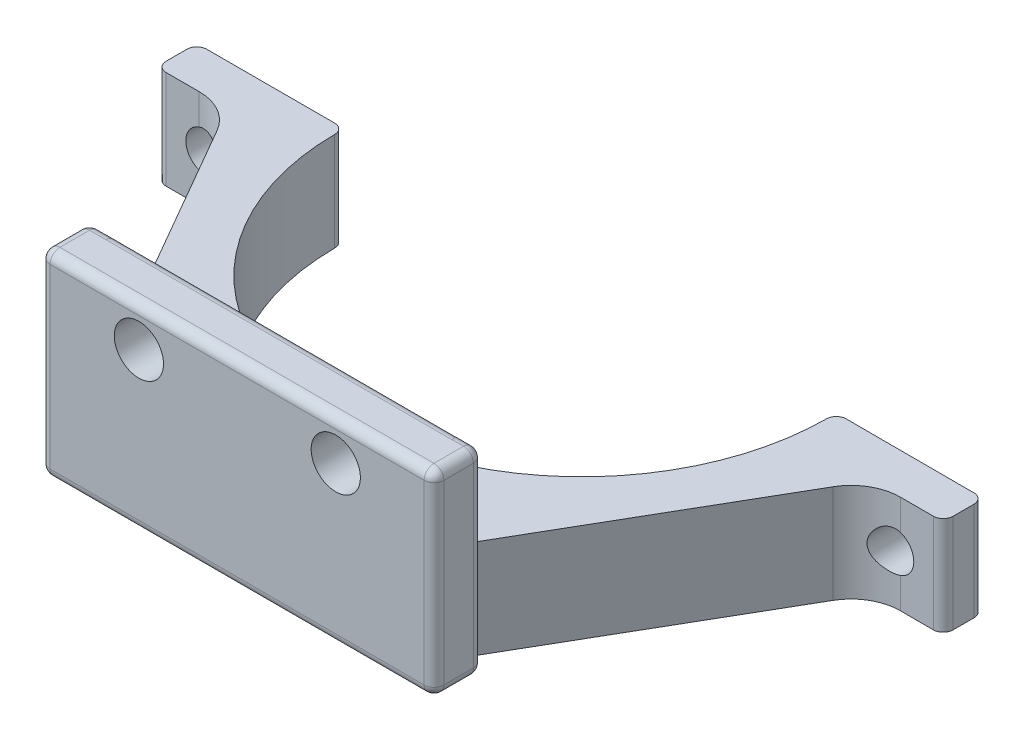
from build123d import *

# Parameters (mm, degrees)
EXTRUDE_2_DEPTH          = 10
CUT_EXTRUDE_1_DEPTH      = 55.083263276
CUT_EXTRUDE_1_DEPTH_BACK = 55.083263276
SKETCH_2_R               = 2
EXTRUDE_4_DEPTH          = 20
SKETCH_4_R               = 2.5
CUT_EXTRUDE_2_DEPTH      = 20
FILLET_1_R               = 1


with BuildPart() as part:
    # 草图1 → 凸台-拉伸2 (new body)
    with BuildSketch(Plane(origin=(0, 0, 0), x_dir=(1, 0, 0), z_dir=(0, 1, 0))):
        with BuildLine():
            Line((19.976699203, -29.999990951), (17.304982924, -29.999990951))
            Line((17.304982924, -29.999990951), (31.312388487, -5.781912211))
            ThreePointArc((31.312388487, -5.781912211), (33.145618934, -3.952237958), (35.648339397, -3.28528067))
            Line((35.648339397, -3.28528067), (38.994935663, -3.290479232))
            ThreePointArc((38.994935663, -3.290479232), (39.702496567, -2.998684777), (39.996487843, -2.292033825))
            Line((39.996487843, -2.292033825), (39.999773177, -0.177085839))
            ThreePointArc((39.999773177, -0.177085839), (39.707978722, 0.530475065), (39.00132777, 0.82446634))
            Line((39.00132777, 0.82446634), (34.146000565, 0.832008547))
            Line((34.146000565, 0.832008547), (26.001089345, 0.844660753))
            ThreePointArc((26.001089345, 0.844660753), (25.295095717, 0.554425262), (24.999553807, -0.1493635))
            ThreePointArc((24.999553807, -0.1493635), (-0.019417331, -24.999992459), (-24.999755664, -0.110529363))
            ThreePointArc((-24.999755664, -0.110529363), (-25.294203962, 0.593717641), (-25.999745891, 0.885049463))
            Line((-25.999745891, 0.885049463), (-39, 0.885049463))
            ThreePointArc((-39, 0.885049463), (-39.707106781, 0.592156244), (-40, -0.114950537))
            Line((-40, -0.114950537), (-40, -2.229901074))
            ThreePointArc((-40, -2.229901074), (-39.707106781, -2.937007856), (-39, -3.229901074))
            Line((-39, -3.229901074), (-35.653399696, -3.229901074))
            ThreePointArc((-35.653399696, -3.229901074), (-33.151718295, -3.900745249), (-31.32133225, -5.733265009))
            Line((-31.32133225, -5.733265009), (-17.343803649, -29.98653823))
            Line((-17.343803649, -29.98653823), (-20.023300797, -29.999990951))
            Line((-20.023300797, -29.999990951), (-20.023300797, -34.999990951))
            Line((-20.023300797, -34.999990951), (19.976699203, -34.999990951))
            Line((19.976699203, -34.999990951), (19.976699203, -29.999990951))
        make_face()
    extrude(amount=EXTRUDE_2_DEPTH)

    # 草图2 → 切除-拉伸1 (cut, two sides: drawn at the far end of the back side and taken through both)
    with BuildSketch(Plane.XY.offset(-CUT_EXTRUDE_1_DEPTH_BACK)):
        with Locations((-35, 5)):
            Circle(SKETCH_2_R)
        with Locations((35, 5)):
            Circle(SKETCH_2_R)
    extrude(amount=CUT_EXTRUDE_1_DEPTH + CUT_EXTRUDE_1_DEPTH_BACK, mode=Mode.SUBTRACT)

    # 草图1<6> → 凸台-拉伸4 (add)
    with BuildSketch(Plane(origin=(0, 0, 0), x_dir=(1, 0, 0), z_dir=(0, 1, 0))):
        Polygon((17.304982924, -29.999990951), (17.297202054, -30.013443673), (-0.023300797, -29.999990951), (-17.343803649, -29.98653823), (-20.023300797, -29.999990951), (-20.023300797, -34.999990951), (19.976699203, -34.999990951), (19.976699203, -29.999990951), align=None)
    extrude(amount=EXTRUDE_4_DEPTH)

    # 草图4 → 切除-拉伸2 (cut)
    with BuildSketch(Plane.XY.offset(34.999990951)):
        with Locations((10, 16)):
            Circle(SKETCH_4_R)
        with Locations((-10, 16)):
            Circle(SKETCH_4_R)
    extrude(amount=-CUT_EXTRUDE_2_DEPTH, mode=Mode.SUBTRACT)

    # 圆角1
    fillet_1_edges = [part.edges().sort_by_distance(p)[0] for p in [
        (-20.023300797, 10, 29.999990951),
        (-20.023300797, 10, 34.999990951),
        (-20.023300797, 0, 32.499990951),
        (19.976699203, 10, 34.999990951),
        (19.976699203, 10, 29.999990951),
        (19.976699203, 0, 32.499990951),
        (17.301092489, 20, 30.006717312),
        (18.640841063, 20, 29.999990951),
        (19.976699203, 20, 32.499990951),
        (-0.023300797, 20, 34.999990951),
        (-20.023300797, 20, 32.499990951),
        (-18.683552223, 20, 29.99326459),
        (-0.023300797, 20, 29.999990951),
        (-18.683552223, 0, 29.99326459),
        (18.640841063, 0, 29.999990951),
        (-0.023300797, 0, 34.999990951),
    ]]
    fillet(fillet_1_edges, radius=FILLET_1_R)


solid = part.part
